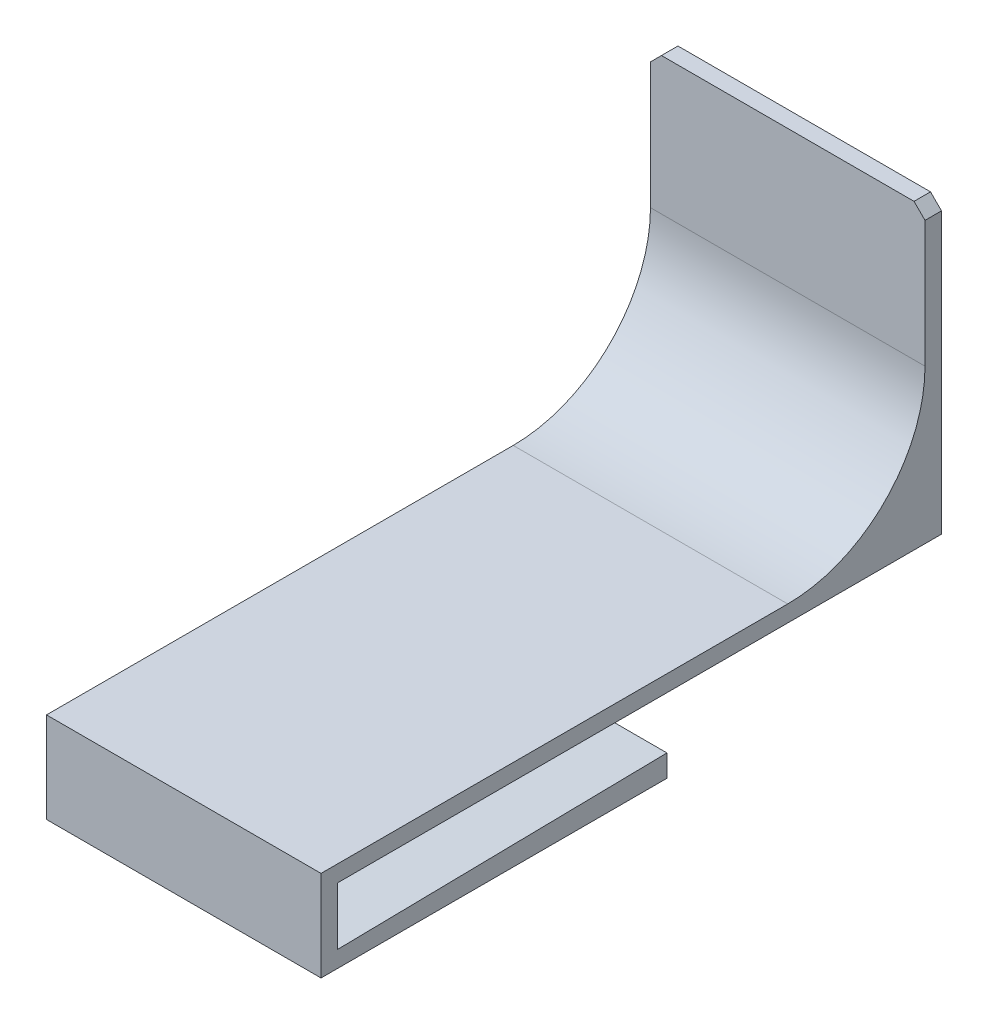
from build123d import *

# Parameters (mm, degrees)
RESSALTO_EXTRUS_O1_DEPTH = 25
CHANFRO1_SIZE            = 2


with BuildPart() as part:
    # Esboço1 → Ressalto-extrusão1 (new, symmetric)
    with BuildSketch(Plane(origin=(0, 0, 0), x_dir=(0, 0, -1), z_dir=(1, 0, 0))):
        with BuildLine():
            Line((0, 0), (-63, 0))
            Line((-63, 0), (-63, 16.5))
            Line((-63, 16.5), (22, 16.5))
            ThreePointArc((22, 16.5), (39.67766953, 23.82233047), (47, 41.5))
            Line((47, 41.5), (47, 66.5))
            Line((47, 66.5), (50, 66.5))
            Line((50, 66.5), (50, 13.5))
            Line((50, 13.5), (-60, 13.5))
            Line((-60, 13.5), (-60, 3))
            Line((-60, 3), (0, 4))
            Line((0, 4), (0, 3))
            Line((0, 3), (0, 0))
        make_face()
    extrude(amount=RESSALTO_EXTRUS_O1_DEPTH, both=True)

    # Chanfro1
    chanfro1_edges = [part.edges().sort_by_distance(p)[0] for p in [
        (-25, 66.5, -48.5),
        (25, 66.5, -48.5),
    ]]
    chamfer(chanfro1_edges, length=CHANFRO1_SIZE)


solid = part.part
